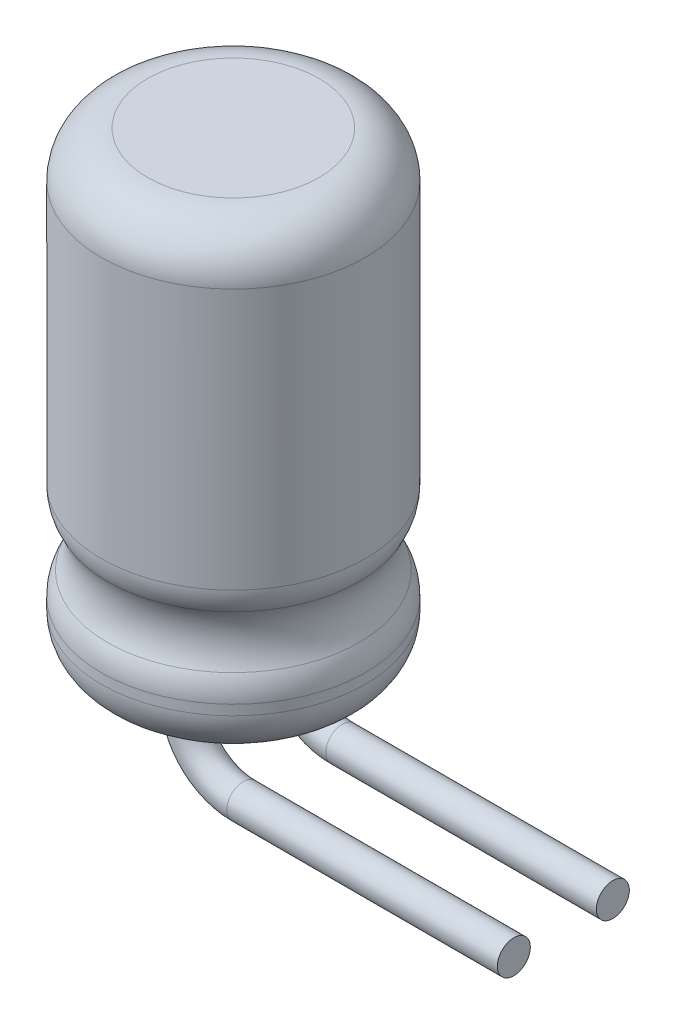
from build123d import *

# Parameters (mm, degrees)
SKETCH_1_R      = 2
EXTRUDE_1_DEPTH = 7
SKETCH_2_R      = 0.25
FILLET_1_R      = 0.7
FILLET_2_R      = 0.7
SKETCH_3_R      = 0.8
FILLET_3_R      = 0.7
FILLET_4_R      = 0.7


with BuildPart() as part:
    # Эскиз1 → Бобышка-Вытянуть1 (new body)
    with BuildSketch(Plane(origin=(0, 0, 0), x_dir=(1, 0, 0), z_dir=(0, 1, 0))):
        with Locations(Location((0, 0, 0), (0, 0, 270))):
            Circle(SKETCH_1_R)
    extrude(amount=EXTRUDE_1_DEPTH)

    # По траектории1: sweep along a curve in space
    with BuildLine() as sweep_1_path:
        Line((0, 0, 0.75), (0, -0.1, 0.75))
        ThreePointArc((0, -0.1, 0.75), (0.263603897, -0.736396103, 0.75), (0.9, -1, 0.75))
        Line((0.9, -1, 0.75), (5, -1, 0.75))
    # Эскиз2 → По траектории1 (sweep)
    with BuildSketch(Plane.XZ):
        with Locations((0, 0.75)):
            Circle(SKETCH_2_R)
    sweep_1 = sweep(path=sweep_1_path.line)

    # Зеркальное отражение1: По траектории1 across plane
    add(sweep_1.mirror(Plane.XY))

    # Скругление1
    fillet_1_edges = [part.edges().sort_by_distance(p)[0] for p in [
        (0, 0, -2),
    ]]
    fillet(fillet_1_edges, radius=FILLET_1_R)

    # Скругление2
    fillet_2_edges = [part.edges().sort_by_distance(p)[0] for p in [
        (0, 7, -2),
    ]]
    fillet(fillet_2_edges, radius=FILLET_2_R)

    # Эскиз3 → Вырез-Повернуть1 (revolve, cut)
    with BuildSketch(Plane(origin=(0, 0, 0), x_dir=(0, 0, -1), z_dir=(1, 0, 0))):
        with Locations((-2.6, 1.6)):
            Circle(SKETCH_3_R)
    revolve(axis=Axis((0, 0, 0), (0, -1, 0)), mode=Mode.SUBTRACT)

    # Скругление3
    fillet_3_edges = [part.edges().sort_by_distance(p)[0] for p in [
        (0, 1.070849738, -2),
    ]]
    fillet(fillet_3_edges, radius=FILLET_3_R)

    # Скругление4
    fillet_4_edges = [part.edges().sort_by_distance(p)[0] for p in [
        (0, 2.129150262, -2),
    ]]
    fillet(fillet_4_edges, radius=FILLET_4_R)


solid = part.part
